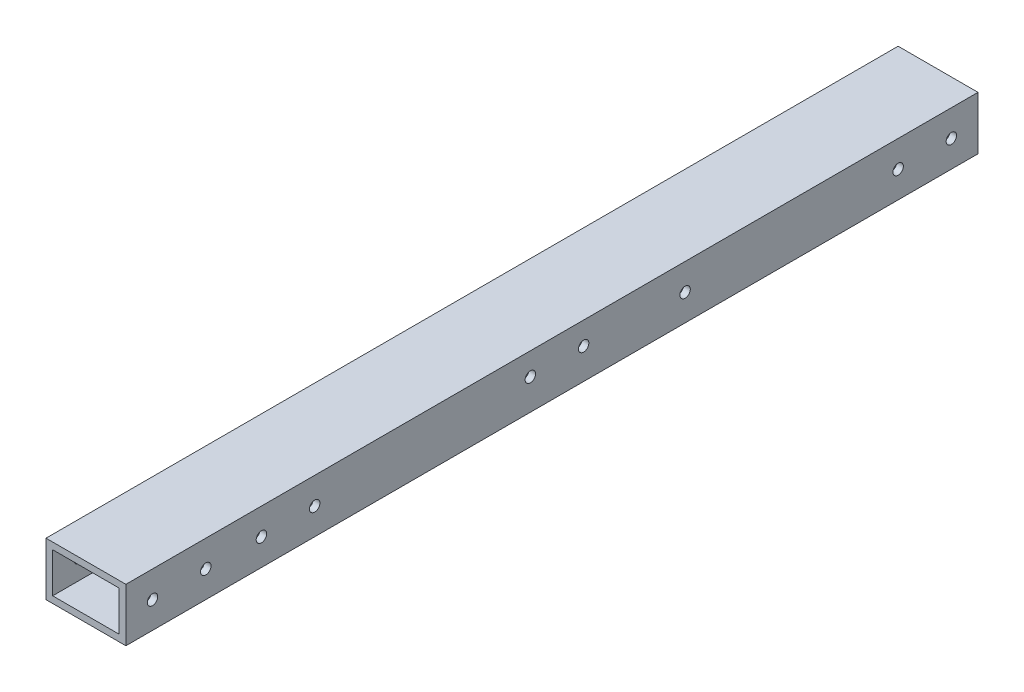
from build123d import *

# Parameters (mm, degrees)
BOSS_EXTRUDE1_DEPTH      = 317.499999
BOSS_EXTRUDE1_DEPTH_BACK = 317.499999
SKETCH3_W                = 38.1
SKETCH3_H                = 25.4
SKETCH3_W_2              = 31.75
SKETCH3_H_2              = 19.05
F_10_CLEARANCE_HOLE2_D   = 4.9784
F_10_CLEARANCE_HOLE4_D   = 4.9784
F_10_CLEARANCE_HOLE3_D   = 4.9784


with BuildPart() as part:
    # Sketch3 → Boss-Extrude1 (new, two sides: drawn at the far end of the back side and taken through both)
    with BuildSketch(Plane.XY.offset(-BOSS_EXTRUDE1_DEPTH_BACK)):
        Rectangle(SKETCH3_W, SKETCH3_H)
        Rectangle(SKETCH3_W_2, SKETCH3_H_2, mode=Mode.SUBTRACT)
    extrude(amount=BOSS_EXTRUDE1_DEPTH + BOSS_EXTRUDE1_DEPTH_BACK)

    # #10 Clearance Hole2 (through all)
    with Locations(Plane.ZY.offset(19.05)):
        with Locations((279.399999492, 0), (304.799999492, 0), (-76.2, 0)):
            Hole(F_10_CLEARANCE_HOLE2_D / 2)

    # #10 Clearance Hole4 (through all)
    with Locations(Plane(origin=(19.05, 0, 0), x_dir=(0, 0, -1), z_dir=(1, 0, 0))):
        with Locations((-252.857000506, 8e-09), (-227.457000506, 1.1e-08), (-124.587000507, 1.943404818), (-99.187000507, 1.943404821)):
            Hole(F_10_CLEARANCE_HOLE4_D / 2)

    # #10 Clearance Hole3 (through all)
    with Locations(Plane.ZY.offset(19.05)):
        with Locations((-50.8, 0), (50.8, 0)):
            Hole(F_10_CLEARANCE_HOLE3_D / 2)

    # SurfaceCut1
    split(bisect_by=Plane(origin=(0, 0, -88.899999492), x_dir=(-1, 0, 0), z_dir=(0, 0, -1)), keep=Keep.BOTTOM)


solid = part.part
